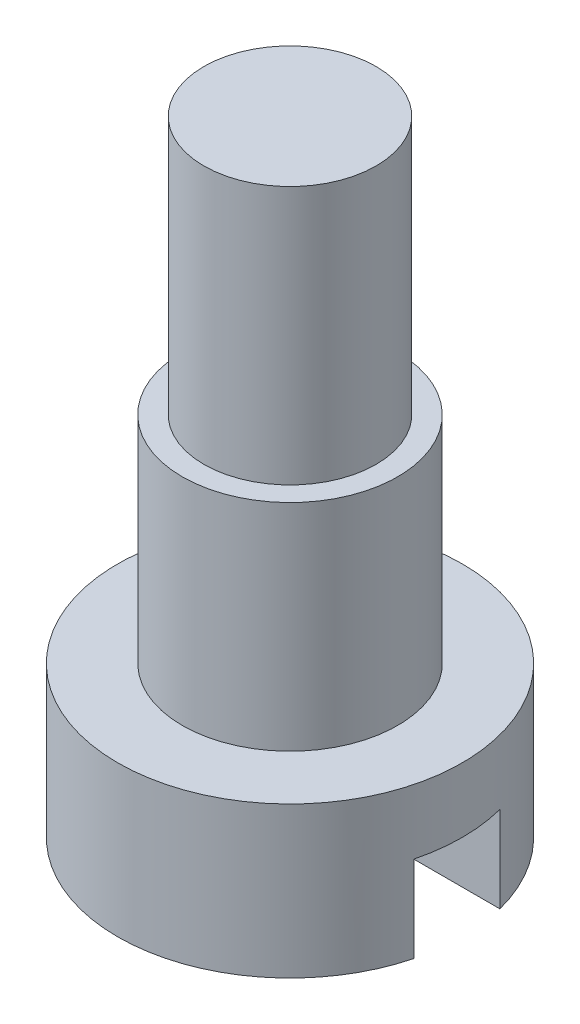
from build123d import *

# Parameters (mm, degrees)
SKETCH1_R               = 8
BOSS_EXTRUDE1_DEPTH     = 7
SKETCH2_R               = 5
BOSS_EXTRUDE2_DEPTH     = 10
CUT_EXTRUDE1_DEPTH      = 10
CUT_EXTRUDE1_DEPTH_BACK = 10
SKETCH3_W               = 4
SKETCH3_H               = 4
SKETCH4_R               = 4
BOSS_EXTRUDE3_DEPTH     = 12


with BuildPart() as part:
    # Sketch1 → Boss-Extrude1 (new body)
    with BuildSketch(Plane(origin=(0, 0, 0), x_dir=(1, 0, 0), z_dir=(0, 1, 0))):
        Circle(SKETCH1_R)
    extrude(amount=-BOSS_EXTRUDE1_DEPTH)

    # Sketch2 → Boss-Extrude2 (add)
    with BuildSketch(Plane(origin=(0, 0, 0), x_dir=(1, 0, 0), z_dir=(0, 1, 0))):
        Circle(SKETCH2_R)
    extrude(amount=BOSS_EXTRUDE2_DEPTH)

    # Sketch3 → Cut-Extrude1 (cut, two sides: drawn at the far end of the back side and taken through both)
    with BuildSketch(Plane(origin=(0, 0, 0), x_dir=(0, 0, -1), z_dir=(1, 0, 0)).offset(-CUT_EXTRUDE1_DEPTH_BACK)):
        with Locations((0, -5)):
            Rectangle(SKETCH3_W, SKETCH3_H)
    extrude(amount=CUT_EXTRUDE1_DEPTH + CUT_EXTRUDE1_DEPTH_BACK, mode=Mode.SUBTRACT)

    # Sketch4 → Boss-Extrude3 (add)
    with BuildSketch(Plane(origin=(0, 10, 0), x_dir=(1, 0, 0), z_dir=(0, 1, 0))):
        Circle(SKETCH4_R)
    extrude(amount=BOSS_EXTRUDE3_DEPTH)


solid = part.part
